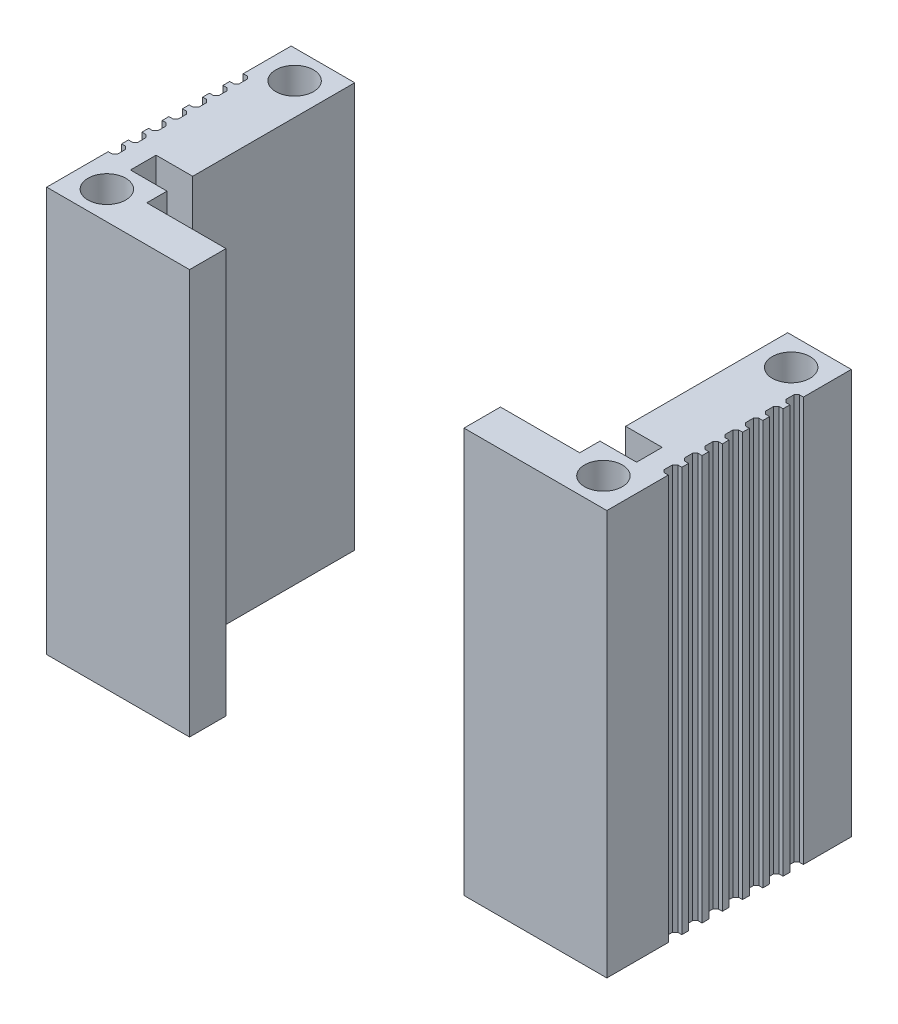
from build123d import *

# Parameters (mm, degrees)
SKETCH_1_W          = 37.47467615
SKETCH_1_H          = 29.97466091
EXTRUDE_1_DEPTH     = 3
SKETCH_2_W          = 3
SKETCH_2_H          = 29.97466091
EXTRUDE_2_DEPTH     = 3
SKETCH_3_W          = 3
SKETCH_3_H          = 29.97466091
EXTRUDE_3_DEPTH     = 3
SKETCH_4_W          = 3
SKETCH_4_H          = 29.97466091
EXTRUDE_4_DEPTH     = 1.6
EXTRUDE_7_DEPTH     = 12.000023
SKETCH_7_W          = 37.47467615
SKETCH_7_H          = 29.97466091
CUT_EXTRUDE_1_DEPTH = 0.3
SKETCH_8_W          = 20.320035554
SKETCH_8_H          = 29.97466091
CUT_EXTRUDE_3_DEPTH = 2.7
SKETCH_9_W          = 5.86876683
SKETCH_9_H          = 29.97466091
CUT_EXTRUDE_4_DEPTH = 1.5
SKETCH_10_W         = 11.577320298
SKETCH_10_H         = 29.97466091
EXTRUDE_8_DEPTH     = 1.5
SKETCH_11_W         = 18.100023376
SKETCH_11_H         = 29.97466091
CUT_EXTRUDE_5_DEPTH = 1
SKETCH_12_W         = 18.100023376
SKETCH_12_H         = 29.97466091
CUT_EXTRUDE_6_DEPTH = 1
CUT_EXTRUDE_7_REACH = 40.903
SKETCH_14_R         = 1.4
CUT_EXTRUDE_8_REACH = 40.903
SKETCH_16_W         = 0.5
SKETCH_16_H         = 1
CHAMFER_1_SIZE      = 0.2
CHAMFER_2_SIZE      = 0.2


with BuildPart() as part:
    # 草图1 → 凸台-拉伸1 (new body)
    with BuildSketch(Plane.XY):
        with Locations((0, 5.449009398)):
            Rectangle(SKETCH_1_W, SKETCH_1_H)
    extrude(amount=EXTRUDE_1_DEPTH)

    # 草图2 → 凸台-拉伸2 (add)
    with BuildSketch(Plane.ZY.offset(18.737338075)):
        with Locations((1.5, 5.449009398)):
            Rectangle(SKETCH_2_W, SKETCH_2_H)
    extrude(amount=EXTRUDE_2_DEPTH)

    # 草图3 → 凸台-拉伸3 (add)
    with BuildSketch(Plane(origin=(18.737338075, 0, 0), x_dir=(0, 0, -1), z_dir=(1, 0, 0))):
        with Locations((-1.5, 5.449009398)):
            Rectangle(SKETCH_3_W, SKETCH_3_H)
    extrude(amount=EXTRUDE_3_DEPTH)

    # 草图4 → 凸台-拉伸4 (add)
    with BuildSketch(Plane(origin=(0, 0, 0), x_dir=(-1, 0, 0), z_dir=(0, 0, -1))):
        with Locations((-20.237338075, 5.449009398)):
            Rectangle(SKETCH_4_W, SKETCH_4_H)
        with Locations((20.237338075, 5.449009398)):
            Rectangle(SKETCH_4_W, SKETCH_4_H)
    extrude(amount=EXTRUDE_4_DEPTH)

    # 草图5 → 凸台-拉伸7 (add)
    with BuildSketch(Plane(origin=(0, 0, -1.6), x_dir=(-1, 0, 0), z_dir=(0, 0, -1))):
        Polygon((-18.737338075, -9.538321057), (-16.028784607, -9.538321057), (-16.028784607, 20.436339853), (-18.737338075, 20.436339853), (-21.737338075, 20.436339853), (-21.737338075, -9.538321057), align=None)
        Polygon((18.737338075, 20.436339853), (21.737338075, 20.436339853), (21.737338075, -9.538321057), (18.737338075, -9.538321057), (16.028784607, -9.538321057), (16.028784607, 20.436339853), align=None)
    extrude(amount=EXTRUDE_7_DEPTH)

    # 草图7 → 切除-拉伸1 (cut)
    with BuildSketch(Plane(origin=(0, 0, 0), x_dir=(-1, 0, 0), z_dir=(0, 0, -1))):
        with Locations((0, 5.449009398)):
            Rectangle(SKETCH_7_W, SKETCH_7_H)
    extrude(amount=-CUT_EXTRUDE_1_DEPTH, mode=Mode.SUBTRACT)

    # 草图8 → 切除-拉伸3 (cut)
    with BuildSketch(Plane.XY.offset(3)):
        with Locations((0, 5.449009398)):
            Rectangle(SKETCH_8_W, SKETCH_8_H)
    extrude(amount=-CUT_EXTRUDE_3_DEPTH, mode=Mode.SUBTRACT)


with BuildPart() as cut_extrude_3_piece_1:
    # of the separate pieces the step leaves, piece 1, a body of its own (cut_extrude_3_pieces)
    add(part.part.solids().sort_by_distance((-21.737338075, -9.538321057, 3))[0])


with BuildPart() as cut_extrude_3_piece_2:
    # of the separate pieces the step leaves, piece 2, a body of its own (cut_extrude_3_pieces)
    add(part.part.solids().sort_by_distance((10.160017777, -9.538321057, 3))[0])


with BuildPart() as cut_extrude_4_tool:
    # 草图9 → 切除-拉伸4 (new body)
    with BuildSketch(Plane(origin=(0, 0, 0.3), x_dir=(-1, 0, 0), z_dir=(0, 0, -1))):
        with Locations((13.094401192, 5.449009398)):
            Rectangle(SKETCH_9_W, SKETCH_9_H)
        with Locations((-13.094401192, 5.449009398)):
            Rectangle(SKETCH_9_W, SKETCH_9_H)
    extrude(amount=-CUT_EXTRUDE_4_DEPTH)


with BuildPart() as cut_extrude_3_piece_1_1:
    add(cut_extrude_3_piece_1.part)

    # 切除-拉伸4: cut by cut_extrude_4_tool
    add(cut_extrude_4_tool.part, mode=Mode.SUBTRACT)



with BuildPart() as cut_extrude_3_piece_2_1:
    add(cut_extrude_3_piece_2.part)

    # 切除-拉伸4: cut by cut_extrude_4_tool
    add(cut_extrude_4_tool.part, mode=Mode.SUBTRACT)


with BuildPart() as cut_extrude_3_piece_1_2:
    add(cut_extrude_3_piece_1_1.part)

    add(cut_extrude_3_piece_2_1.part)  # 凸台-拉伸8 merges 切除-拉伸3 piece 2
    # 草图10 → 凸台-拉伸8 (add)
    with BuildSketch(Plane.XY.offset(3)):
        with Locations((-15.948677926, 5.449009398)):
            Rectangle(SKETCH_10_W, SKETCH_10_H)
        with Locations((15.948677926, 5.449009398)):
            Rectangle(SKETCH_10_W, SKETCH_10_H)
    extrude(amount=EXTRUDE_8_DEPTH)

    # 草图11 → 切除-拉伸5 (cut)
    with BuildSketch(Plane(origin=(21.737338075, 0, 0), x_dir=(0, 0, -1), z_dir=(1, 0, 0))):
        with Locations((4.550011688, 5.449009398)):
            Rectangle(SKETCH_11_W, SKETCH_11_H)
    extrude(amount=-CUT_EXTRUDE_5_DEPTH, mode=Mode.SUBTRACT)

    # 草图12 → 切除-拉伸6 (cut)
    with BuildSketch(Plane.ZY.offset(21.737338075)):
        with Locations((-4.550011688, 5.449009398)):
            Rectangle(SKETCH_12_W, SKETCH_12_H)
    extrude(amount=-CUT_EXTRUDE_6_DEPTH, mode=Mode.SUBTRACT)

    # 草图14 → 切除-拉伸7 (cut, up to next)
    with BuildSketch(Plane.XZ.offset(9.538321057), mode=Mode.PRIVATE) as cut_extrude_7_sk1:
        with Locations(Location((18.383061341, -11.500023376, 0), (0, 0, 270))):
            Circle(SKETCH_14_R)
    cut_extrude_7_tool1 = extrude(cut_extrude_7_sk1.sketch, amount=-CUT_EXTRUDE_7_REACH, mode=Mode.PRIVATE) & cut_extrude_3_piece_1_2.part
    # 草图14 → 切除-拉伸7 (cut, up to next)
    with BuildSketch(Plane.XZ.offset(9.538321057), mode=Mode.PRIVATE) as cut_extrude_7_sk2:
        with Locations(Location((18.383061341, 2.4, 0), (0, 0, 270))):
            Circle(SKETCH_14_R)
    cut_extrude_7_tool2 = extrude(cut_extrude_7_sk2.sketch, amount=-CUT_EXTRUDE_7_REACH, mode=Mode.PRIVATE) & cut_extrude_3_piece_1_2.part
    # 草图14 → 切除-拉伸7 (cut, up to next)
    with BuildSketch(Plane.XZ.offset(9.538321057), mode=Mode.PRIVATE) as cut_extrude_7_sk3:
        with Locations(Location((-18.383061341, 2.4, 0), (0, 0, 270))):
            Circle(SKETCH_14_R)
    cut_extrude_7_tool3 = extrude(cut_extrude_7_sk3.sketch, amount=-CUT_EXTRUDE_7_REACH, mode=Mode.PRIVATE) & cut_extrude_3_piece_1_2.part
    # 草图14 → 切除-拉伸7 (cut, up to next)
    with BuildSketch(Plane.XZ.offset(9.538321057), mode=Mode.PRIVATE) as cut_extrude_7_sk4:
        with Locations(Location((-18.383061341, -11.500023376, 0), (0, 0, 270))):
            Circle(SKETCH_14_R)
    cut_extrude_7_tool4 = extrude(cut_extrude_7_sk4.sketch, amount=-CUT_EXTRUDE_7_REACH, mode=Mode.PRIVATE) & cut_extrude_3_piece_1_2.part
    add(cut_extrude_7_tool1.solids().sort_by_distance((18.383061, -9.538321, -11.500023))[0], mode=Mode.SUBTRACT)
    add(cut_extrude_7_tool2.solids().sort_by_distance((18.383061, -9.538321, 2.4))[0], mode=Mode.SUBTRACT)
    add(cut_extrude_7_tool3.solids().sort_by_distance((-18.383061, -9.538321, 2.4))[0], mode=Mode.SUBTRACT)
    add(cut_extrude_7_tool4.solids().sort_by_distance((-18.383061, -9.538321, -11.500023))[0], mode=Mode.SUBTRACT)

    # 草图16 → 切除-拉伸8 (cut, up to next)
    with BuildSketch(Plane.XZ.offset(9.538321057), mode=Mode.PRIVATE) as cut_extrude_8_sk1:
        with Locations((20.487338075, -9.550011688)):
            Rectangle(SKETCH_16_W, SKETCH_16_H)
    cut_extrude_8_tool1 = extrude(cut_extrude_8_sk1.sketch, amount=-CUT_EXTRUDE_8_REACH, mode=Mode.PRIVATE) & cut_extrude_3_piece_1_2.part
    # 草图16 → 切除-拉伸8 (cut, up to next)
    with BuildSketch(Plane.XZ.offset(9.538321057), mode=Mode.PRIVATE) as cut_extrude_8_sk2:
        with Locations((20.487338075, -8.050011688)):
            Rectangle(SKETCH_16_W, SKETCH_16_H)
    cut_extrude_8_tool2 = extrude(cut_extrude_8_sk2.sketch, amount=-CUT_EXTRUDE_8_REACH, mode=Mode.PRIVATE) & cut_extrude_3_piece_1_2.part
    # 草图16 → 切除-拉伸8 (cut, up to next)
    with BuildSketch(Plane.XZ.offset(9.538321057), mode=Mode.PRIVATE) as cut_extrude_8_sk3:
        with Locations((20.487338075, -6.550011688)):
            Rectangle(SKETCH_16_W, SKETCH_16_H)
    cut_extrude_8_tool3 = extrude(cut_extrude_8_sk3.sketch, amount=-CUT_EXTRUDE_8_REACH, mode=Mode.PRIVATE) & cut_extrude_3_piece_1_2.part
    # 草图16 → 切除-拉伸8 (cut, up to next)
    with BuildSketch(Plane.XZ.offset(9.538321057), mode=Mode.PRIVATE) as cut_extrude_8_sk4:
        with Locations((20.487338075, -5.050011688)):
            Rectangle(SKETCH_16_W, SKETCH_16_H)
    cut_extrude_8_tool4 = extrude(cut_extrude_8_sk4.sketch, amount=-CUT_EXTRUDE_8_REACH, mode=Mode.PRIVATE) & cut_extrude_3_piece_1_2.part
    # 草图16 → 切除-拉伸8 (cut, up to next)
    with BuildSketch(Plane.XZ.offset(9.538321057), mode=Mode.PRIVATE) as cut_extrude_8_sk5:
        with Locations((20.487338075, -3.550011688)):
            Rectangle(SKETCH_16_W, SKETCH_16_H)
    cut_extrude_8_tool5 = extrude(cut_extrude_8_sk5.sketch, amount=-CUT_EXTRUDE_8_REACH, mode=Mode.PRIVATE) & cut_extrude_3_piece_1_2.part
    # 草图16 → 切除-拉伸8 (cut, up to next)
    with BuildSketch(Plane.XZ.offset(9.538321057), mode=Mode.PRIVATE) as cut_extrude_8_sk6:
        with Locations((20.487338075, -2.050011688)):
            Rectangle(SKETCH_16_W, SKETCH_16_H)
    cut_extrude_8_tool6 = extrude(cut_extrude_8_sk6.sketch, amount=-CUT_EXTRUDE_8_REACH, mode=Mode.PRIVATE) & cut_extrude_3_piece_1_2.part
    # 草图16 → 切除-拉伸8 (cut, up to next)
    with BuildSketch(Plane.XZ.offset(9.538321057), mode=Mode.PRIVATE) as cut_extrude_8_sk7:
        with Locations((20.487338075, -0.550011688)):
            Rectangle(SKETCH_16_W, SKETCH_16_H)
    cut_extrude_8_tool7 = extrude(cut_extrude_8_sk7.sketch, amount=-CUT_EXTRUDE_8_REACH, mode=Mode.PRIVATE) & cut_extrude_3_piece_1_2.part
    # 草图16 → 切除-拉伸8 (cut, up to next)
    with BuildSketch(Plane.XZ.offset(9.538321057), mode=Mode.PRIVATE) as cut_extrude_8_sk8:
        with Locations((-20.487338075, -9.550011688)):
            Rectangle(SKETCH_16_W, SKETCH_16_H)
    cut_extrude_8_tool8 = extrude(cut_extrude_8_sk8.sketch, amount=-CUT_EXTRUDE_8_REACH, mode=Mode.PRIVATE) & cut_extrude_3_piece_1_2.part
    # 草图16 → 切除-拉伸8 (cut, up to next)
    with BuildSketch(Plane.XZ.offset(9.538321057), mode=Mode.PRIVATE) as cut_extrude_8_sk9:
        with Locations((-20.487338075, -8.050011688)):
            Rectangle(SKETCH_16_W, SKETCH_16_H)
    cut_extrude_8_tool9 = extrude(cut_extrude_8_sk9.sketch, amount=-CUT_EXTRUDE_8_REACH, mode=Mode.PRIVATE) & cut_extrude_3_piece_1_2.part
    # 草图16 → 切除-拉伸8 (cut, up to next)
    with BuildSketch(Plane.XZ.offset(9.538321057), mode=Mode.PRIVATE) as cut_extrude_8_sk10:
        with Locations((-20.487338075, -6.550011688)):
            Rectangle(SKETCH_16_W, SKETCH_16_H)
    cut_extrude_8_tool10 = extrude(cut_extrude_8_sk10.sketch, amount=-CUT_EXTRUDE_8_REACH, mode=Mode.PRIVATE) & cut_extrude_3_piece_1_2.part
    # 草图16 → 切除-拉伸8 (cut, up to next)
    with BuildSketch(Plane.XZ.offset(9.538321057), mode=Mode.PRIVATE) as cut_extrude_8_sk11:
        with Locations((-20.487338075, -5.050011688)):
            Rectangle(SKETCH_16_W, SKETCH_16_H)
    cut_extrude_8_tool11 = extrude(cut_extrude_8_sk11.sketch, amount=-CUT_EXTRUDE_8_REACH, mode=Mode.PRIVATE) & cut_extrude_3_piece_1_2.part
    # 草图16 → 切除-拉伸8 (cut, up to next)
    with BuildSketch(Plane.XZ.offset(9.538321057), mode=Mode.PRIVATE) as cut_extrude_8_sk12:
        with Locations((-20.487338075, -0.550011688)):
            Rectangle(SKETCH_16_W, SKETCH_16_H)
    cut_extrude_8_tool12 = extrude(cut_extrude_8_sk12.sketch, amount=-CUT_EXTRUDE_8_REACH, mode=Mode.PRIVATE) & cut_extrude_3_piece_1_2.part
    # 草图16 → 切除-拉伸8 (cut, up to next)
    with BuildSketch(Plane.XZ.offset(9.538321057), mode=Mode.PRIVATE) as cut_extrude_8_sk13:
        with Locations((-20.487338075, -2.050011688)):
            Rectangle(SKETCH_16_W, SKETCH_16_H)
    cut_extrude_8_tool13 = extrude(cut_extrude_8_sk13.sketch, amount=-CUT_EXTRUDE_8_REACH, mode=Mode.PRIVATE) & cut_extrude_3_piece_1_2.part
    # 草图16 → 切除-拉伸8 (cut, up to next)
    with BuildSketch(Plane.XZ.offset(9.538321057), mode=Mode.PRIVATE) as cut_extrude_8_sk14:
        with Locations((-20.487338075, -3.550011688)):
            Rectangle(SKETCH_16_W, SKETCH_16_H)
    cut_extrude_8_tool14 = extrude(cut_extrude_8_sk14.sketch, amount=-CUT_EXTRUDE_8_REACH, mode=Mode.PRIVATE) & cut_extrude_3_piece_1_2.part
    add(cut_extrude_8_tool1.solids().sort_by_distance((20.487338, -9.538321, -9.550012))[0], mode=Mode.SUBTRACT)
    add(cut_extrude_8_tool2.solids().sort_by_distance((20.487338, -9.538321, -8.050012))[0], mode=Mode.SUBTRACT)
    add(cut_extrude_8_tool3.solids().sort_by_distance((20.487338, -9.538321, -6.550012))[0], mode=Mode.SUBTRACT)
    add(cut_extrude_8_tool4.solids().sort_by_distance((20.487338, -9.538321, -5.050012))[0], mode=Mode.SUBTRACT)
    add(cut_extrude_8_tool5.solids().sort_by_distance((20.487338, -9.538321, -3.550012))[0], mode=Mode.SUBTRACT)
    add(cut_extrude_8_tool6.solids().sort_by_distance((20.487338, -9.538321, -2.050012))[0], mode=Mode.SUBTRACT)
    add(cut_extrude_8_tool7.solids().sort_by_distance((20.487338, -9.538321, -0.550012))[0], mode=Mode.SUBTRACT)
    add(cut_extrude_8_tool8.solids().sort_by_distance((-20.487338, -9.538321, -9.550012))[0], mode=Mode.SUBTRACT)
    add(cut_extrude_8_tool9.solids().sort_by_distance((-20.487338, -9.538321, -8.050012))[0], mode=Mode.SUBTRACT)
    add(cut_extrude_8_tool10.solids().sort_by_distance((-20.487338, -9.538321, -6.550012))[0], mode=Mode.SUBTRACT)
    add(cut_extrude_8_tool11.solids().sort_by_distance((-20.487338, -9.538321, -5.050012))[0], mode=Mode.SUBTRACT)
    add(cut_extrude_8_tool12.solids().sort_by_distance((-20.487338, -9.538321, -0.550012))[0], mode=Mode.SUBTRACT)
    add(cut_extrude_8_tool13.solids().sort_by_distance((-20.487338, -9.538321, -2.050012))[0], mode=Mode.SUBTRACT)
    add(cut_extrude_8_tool14.solids().sort_by_distance((-20.487338, -9.538321, -3.550012))[0], mode=Mode.SUBTRACT)

    # 倒角1
    chamfer_1_edges = [cut_extrude_3_piece_1_2.edges().sort_by_distance(p)[0] for p in [
        (20.237338075, 5.449009398, -10.050011688),
        (20.237338075, 5.449009398, -9.050011688),
        (20.237338075, 5.449009398, -8.550011688),
        (20.237338075, 5.449009398, -7.550011688),
        (20.237338075, 5.449009398, -7.050011688),
        (20.237338075, 5.449009398, -6.050011688),
        (20.237338075, 5.449009398, -5.550011688),
        (20.237338075, 5.449009398, -4.550011688),
        (20.237338075, 5.449009398, -4.050011688),
        (20.237338075, 5.449009398, -3.050011688),
        (20.237338075, 5.449009398, -2.550011688),
        (20.237338075, 5.449009398, -1.550011688),
        (20.237338075, 5.449009398, -1.050011688),
        (20.237338075, 5.449009398, -0.050011688),
    ]]
    chamfer(chamfer_1_edges, length=CHAMFER_1_SIZE)

    # 倒角2
    chamfer_2_edges = [cut_extrude_3_piece_1_2.edges().sort_by_distance(p)[0] for p in [
        (-20.237338075, 5.449009398, -10.050011688),
        (-20.237338075, 5.449009398, -9.050011688),
        (-20.237338075, 5.449009398, -8.550011688),
        (-20.237338075, 5.449009398, -7.550011688),
        (-20.237338075, 5.449009398, -7.050011688),
        (-20.237338075, 5.449009398, -6.050011688),
        (-20.237338075, 5.449009398, -5.550011688),
        (-20.237338075, 5.449009398, -4.550011688),
        (-20.237338075, 5.449009398, -1.050011688),
        (-20.237338075, 5.449009398, -0.050011688),
        (-20.237338075, 5.449009398, -2.550011688),
        (-20.237338075, 5.449009398, -1.550011688),
        (-20.237338075, 5.449009398, -4.050011688),
        (-20.237338075, 5.449009398, -3.050011688),
    ]]
    chamfer(chamfer_2_edges, length=CHAMFER_2_SIZE)


solid = cut_extrude_3_piece_1_2.part
